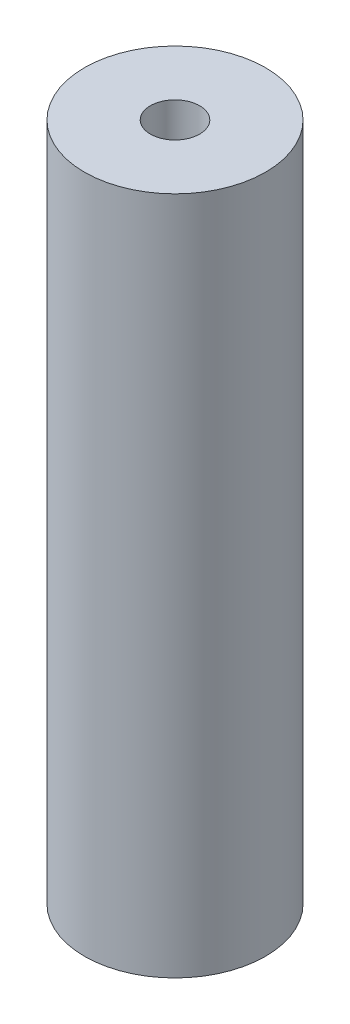
from build123d import *

# Parameters (mm, degrees)
SKETCH1_R           = 6.35
SKETCH1_R_2         = 1.7272
BOSS_EXTRUDE1_DEPTH = 23.8125


with BuildPart() as part:
    # Sketch1 → Boss-Extrude1 (new, symmetric)
    with BuildSketch(Plane(origin=(0, 0, 0), x_dir=(1, 0, 0), z_dir=(0, 1, 0))):
        with Locations(Location((0, 0, 0), (0, 0, 270))):
            Circle(SKETCH1_R)
        with Locations(Location((0, 0, 0), (0, 0, 270))):
            Circle(SKETCH1_R_2, mode=Mode.SUBTRACT)
    extrude(amount=BOSS_EXTRUDE1_DEPTH, both=True)


solid = part.part
